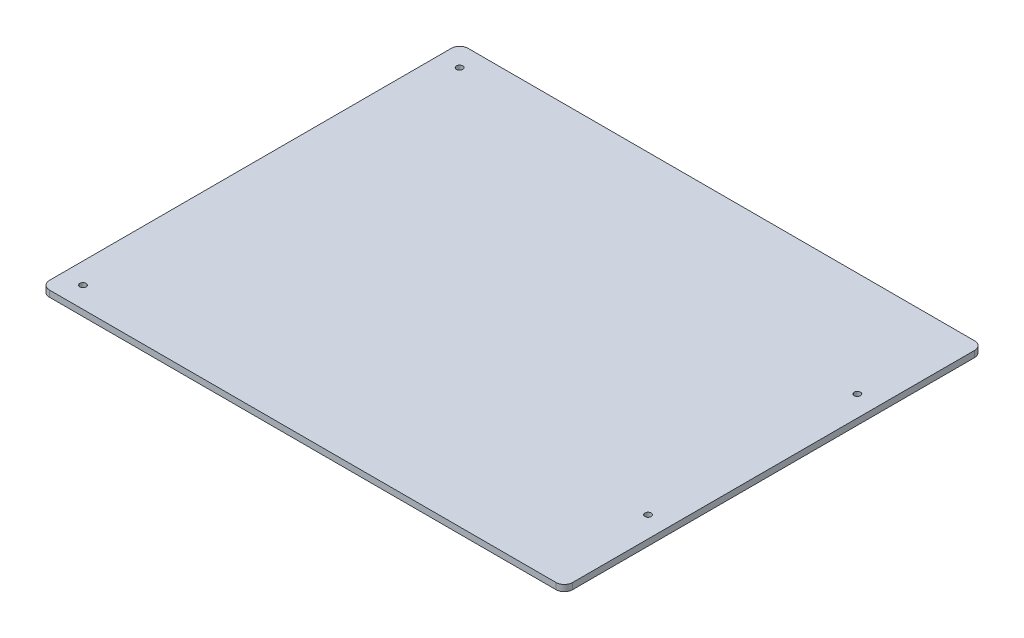
from build123d import *

# Parameters (mm, degrees)
SKETCH1_W           = 250
SKETCH1_H           = 200
SKETCH1_R           = 1.5
BOSS_EXTRUDE1_DEPTH = 3
FILLET1_R           = 4


with BuildPart() as part:
    # Sketch1 → Boss-Extrude1 (new body)
    with BuildSketch(Plane(origin=(0, 0, 0), x_dir=(1, 0, 0), z_dir=(0, 1, 0))):
        Rectangle(SKETCH1_W, SKETCH1_H)
        with Locations(Location((-115, 90, 0), (0, 0, 270))):
            Circle(SKETCH1_R, mode=Mode.SUBTRACT)
        with Locations(Location((115, 50, 0), (0, 0, 270))):
            Circle(SKETCH1_R, mode=Mode.SUBTRACT)
        with Locations(Location((115, -50, 0), (0, 0, 90))):
            Circle(SKETCH1_R, mode=Mode.SUBTRACT)
        with Locations(Location((-115, -90, 0), (0, 0, 90))):
            Circle(SKETCH1_R, mode=Mode.SUBTRACT)
    extrude(amount=BOSS_EXTRUDE1_DEPTH)

    # Fillet1
    fillet1_edges = [part.edges().sort_by_distance(p)[0] for p in [
        (125, 1.5, 100),
        (-125, 1.5, 100),
        (-125, 1.5, -100),
        (125, 1.5, -100),
    ]]
    fillet(fillet1_edges, radius=FILLET1_R)


solid = part.part
